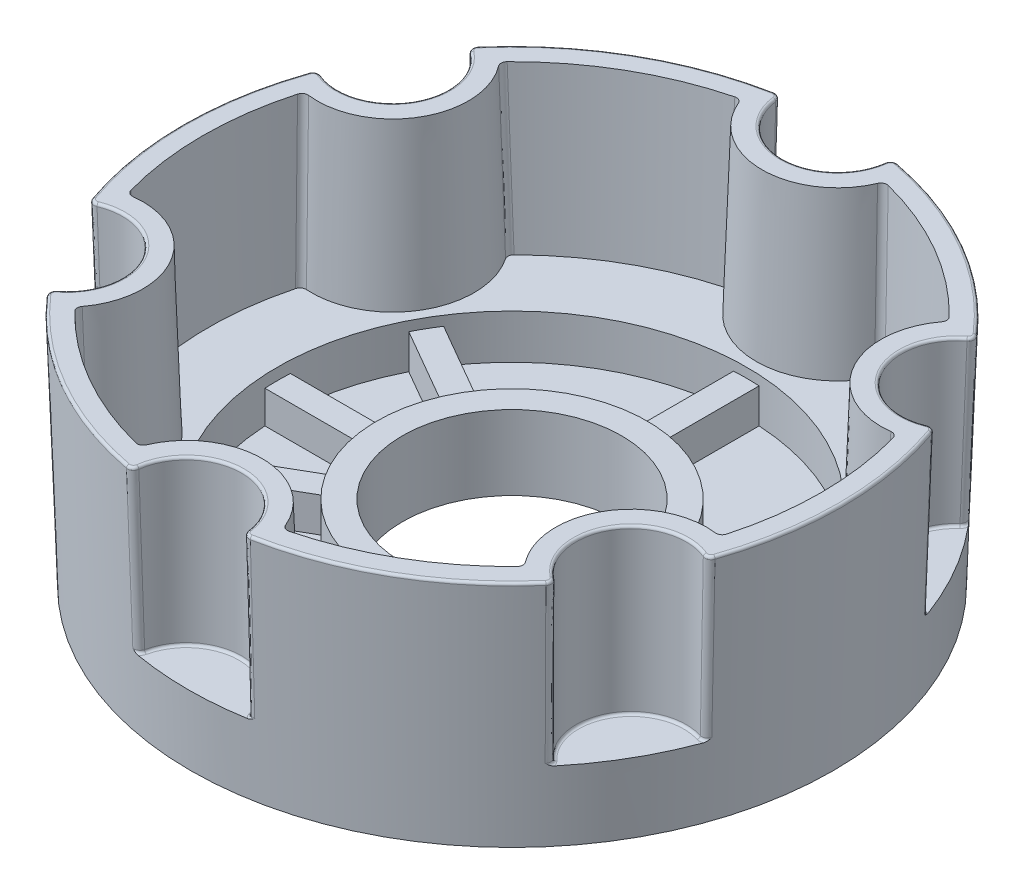
from build123d import *

# Parameters (mm, degrees)
CROQUIS1_R              = 31.5
SALIENTE_EXTRUIR1_DEPTH = 23
SALIENTE_EXTRUIR1_DRAFT = -2
CROQUIS2_R              = 5.407925635
CORTAR_EXTRUIR1_DEPTH   = 16
CROQUIS3_R              = 10.75
CORTAR_EXTRUIR2_DEPTH   = 16
CORTAR_EXTRUIR3_DEPTH   = 16
CORTAR_EXTRUIR3_DRAFT   = -2
CROQUIS6_R              = 23
CROQUIS6_R_2            = 13.25
CORTAR_EXTRUIR4_DEPTH   = 4.35
SALIENTE_EXTRUIR2_START = 3.4
SALIENTE_EXTRUIR2_DEPTH = 3.4
SALIENTE_EXTRUIR3_START = 3.2
SALIENTE_EXTRUIR3_DEPTH = 3.2
MATRIZC3_COUNT          = 4
CROQUIS10_R             = 13.25
CROQUIS10_R_2           = 10.75
SALIENTE_EXTRUIR4_DEPTH = 0.3
REDONDEO4_R             = 0.6
REDONDEO6_R             = 0.25
REDONDEO7_R             = 0.25
CROQUIS11_R             = 1
CORTAR_EXTRUIR5_DEPTH   = 1


with BuildPart() as part:
    # Croquis1 → Saliente-Extruir1 (with draft: the straight prism first)
    with BuildSketch(Plane(origin=(0, 0, 0), x_dir=(1, 0, 0), z_dir=(0, 1, 0))):
        Circle(CROQUIS1_R)
    extrude(amount=SALIENTE_EXTRUIR1_DEPTH)
    # Saliente-Extruir1: the draft: its side faces are tilted about the plane it starts from
    saliente_extruir1_sides = [part.faces().sort_by_distance(p)[0] for p in [
        (-31.5, 11.5, 0),
    ]]
    draft(saliente_extruir1_sides, Plane(origin=(0, 0, 0), x_dir=(1, 0, 0), z_dir=(0, 1, 0)), SALIENTE_EXTRUIR1_DRAFT)

    # Croquis2 → Cortar-Extruir1 (cut)
    with BuildSketch(Plane(origin=(0, 23, 0), x_dir=(1, 0, 0), z_dir=(0, 1, 0))):
        with Locations((0, 31.907925635)):
            Circle(CROQUIS2_R)
        with Locations((27.633074182, 15.953962817)):
            Circle(CROQUIS2_R)
        with Locations((27.633074182, -15.953962817)):
            Circle(CROQUIS2_R)
        with Locations((0, -31.907925635)):
            Circle(CROQUIS2_R)
        with Locations((-27.633074182, -15.953962817)):
            Circle(CROQUIS2_R)
        with Locations((-27.633074182, 15.953962817)):
            Circle(CROQUIS2_R)
    extrude(amount=-CORTAR_EXTRUIR1_DEPTH, mode=Mode.SUBTRACT)

    # Croquis3 → Cortar-Extruir2 (cut)
    with BuildSketch(Plane.XZ):
        with Locations(Location((0, 0, 0), (0, 0, 270))):
            Circle(CROQUIS3_R)
    extrude(amount=-CORTAR_EXTRUIR2_DEPTH, mode=Mode.SUBTRACT)


with BuildPart() as cortar_extruir3_tool:
    # Croquis4 → Cortar-Extruir3 (with draft: the straight prism first)
    with BuildSketch(Plane(origin=(0, 23, 0), x_dir=(1, 0, 0), z_dir=(0, 1, 0))):
        with BuildLine():
            ThreePointArc((-7, 29.483598468), (-15.151588849, 26.243321702), (-22.033545268, 20.80397706))
            ThreePointArc((-22.033545268, 20.80397706), (-21.217622393, 12.25), (-29.033545268, 8.679621407))
            ThreePointArc((-29.033545268, 8.679621407), (-30.303177698, 0), (-29.033545268, -8.679621407))
            ThreePointArc((-29.033545268, -8.679621407), (-21.217622393, -12.25), (-22.033545268, -20.80397706))
            ThreePointArc((-22.033545268, -20.80397706), (-15.151588849, -26.243321702), (-7, -29.483598468))
            ThreePointArc((-7, -29.483598468), (0, -24.5), (7, -29.483598468))
            ThreePointArc((7, -29.483598468), (15.151588849, -26.243321702), (22.033545268, -20.80397706))
            ThreePointArc((22.033545268, -20.80397706), (21.217622393, -12.25), (29.033545268, -8.679621407))
            ThreePointArc((29.033545268, -8.679621407), (30.303177698, 0), (29.033545268, 8.679621407))
            ThreePointArc((29.033545268, 8.679621407), (21.217622393, 12.25), (22.033545268, 20.80397706))
            ThreePointArc((22.033545268, 20.80397706), (15.151588849, 26.243321702), (7, 29.483598468))
            ThreePointArc((7, 29.483598468), (0, 24.5), (-7, 29.483598468))
        make_face()
    extrude(amount=-CORTAR_EXTRUIR3_DEPTH)
    # Cortar-Extruir3: the draft: its side faces are tilted about the plane it starts from
    cortar_extruir3_sides = [cortar_extruir3_tool.faces().sort_by_distance(p)[0] for p in [
        (21.217622393, 15, 12.25),
        (30.303177698, 15, 0),
        (21.217622393, 15, -12.25),
        (15.151588849, 15, -26.243321702),
        (0, 15, -24.5),
        (-15.151588849, 15, -26.243321702),
        (-21.217622393, 15, -12.25),
        (-30.303177698, 15, 0),
        (-21.217622393, 15, 12.25),
        (-15.151588849, 15, 26.243321702),
        (0, 15, 24.5),
        (15.151588849, 15, 26.243321702),
    ]]
    draft(cortar_extruir3_sides, Plane(origin=(0, 23, 0), x_dir=(1, 0, 0), z_dir=(0, 1, 0)), CORTAR_EXTRUIR3_DRAFT)


with BuildPart() as part_1:
    add(part.part)

    # Cortar-Extruir3: cut by cortar_extruir3_tool
    add(cortar_extruir3_tool.part, mode=Mode.SUBTRACT)

    # Croquis6 → Cortar-Extruir4 (cut)
    with BuildSketch(Plane(origin=(0, 7, 0), x_dir=(1, 0, 0), z_dir=(0, 1, 0))):
        with Locations(Location((0, 0, 0), (0, 0, 270))):
            Circle(CROQUIS6_R)
        with Locations(Location((0, 0, 0), (0, 0, 270))):
            Circle(CROQUIS6_R_2, mode=Mode.SUBTRACT)
    extrude(amount=-CORTAR_EXTRUIR4_DEPTH, mode=Mode.SUBTRACT)

    # Croquis8 → Saliente-Extruir2 (add)
    with BuildSketch(Plane(origin=(0, 2.65, 0), x_dir=(1, 0, 0), z_dir=(0, 1, 0)).offset(SALIENTE_EXTRUIR2_START)):
        with BuildLine():
            Line((-10.798659659, 7.677984734), (-19.264145909, 12.565535499))
            ThreePointArc((-19.264145909, 12.565535499), (-19.918584287, 11.5), (-20.514145909, 10.40047199))
            Line((-20.514145909, 10.40047199), (-12.048659659, 5.512921224))
            ThreePointArc((-12.048659659, 5.512921224), (-11.4748366, 6.625), (-10.798659659, 7.677984734))
        make_face()
        with BuildLine():
            Line((1.25, 13.190905958), (1.25, 22.966007489))
            ThreePointArc((1.25, 22.966007489), (0, 23), (-1.25, 22.966007489))
            Line((-1.25, 22.966007489), (-1.25, 13.190905958))
            ThreePointArc((-1.25, 13.190905958), (0, 13.25), (1.25, 13.190905958))
        make_face()
        with BuildLine():
            ThreePointArc((20.514145909, 10.40047199), (19.918584287, 11.5), (19.264145909, 12.565535499))
            Line((19.264145909, 12.565535499), (10.798659659, 7.677984734))
            ThreePointArc((10.798659659, 7.677984734), (11.4748366, 6.625), (12.048659659, 5.512921224))
            Line((12.048659659, 5.512921224), (20.514145909, 10.40047199))
        make_face()
        with BuildLine():
            ThreePointArc((19.264145909, -12.565535499), (19.918584287, -11.5), (20.514145909, -10.40047199))
            Line((20.514145909, -10.40047199), (12.048659659, -5.512921224))
            ThreePointArc((12.048659659, -5.512921224), (11.4748366, -6.625), (10.798659659, -7.677984734))
            Line((10.798659659, -7.677984734), (19.264145909, -12.565535499))
        make_face()
        with BuildLine():
            ThreePointArc((1.25, -13.190905958), (0, -13.25), (-1.25, -13.190905958))
            Line((-1.25, -13.190905958), (-1.25, -22.966007489))
            ThreePointArc((-1.25, -22.966007489), (0, -23), (1.25, -22.966007489))
            Line((1.25, -22.966007489), (1.25, -13.190905958))
        make_face()
        with BuildLine():
            Line((-19.264145909, -12.565535499), (-10.798659659, -7.677984734))
            ThreePointArc((-10.798659659, -7.677984734), (-11.4748366, -6.625), (-12.048659659, -5.512921224))
            Line((-12.048659659, -5.512921224), (-20.514145909, -10.40047199))
            ThreePointArc((-20.514145909, -10.40047199), (-19.918584287, -11.5), (-19.264145909, -12.565535499))
        make_face()
    extrude(amount=-SALIENTE_EXTRUIR2_DEPTH)

    # Croquis9 → Saliente-Extruir3 (add)
    with BuildSketch(Plane(origin=(0, 2.65, 0), x_dir=(1, 0, 0), z_dir=(0, 1, 0)).offset(SALIENTE_EXTRUIR3_START)):
        with BuildLine():
            ThreePointArc((13.190905958, 1.25), (13.235218244, 0.625698031), (13.25, 0))
            Line((13.25, 0), (23, 0))
            ThreePointArc((23, 0), (22.991500302, 0.625231055), (22.966007489, 1.25))
            Line((22.966007489, 1.25), (13.190905958, 1.25))
        make_face()
        with BuildLine():
            Line((23, 0), (13.25, 0))
            ThreePointArc((13.25, 0), (13.235218244, -0.625698031), (13.190905958, -1.25))
            Line((13.190905958, -1.25), (22.966007489, -1.25))
            ThreePointArc((22.966007489, -1.25), (22.991500302, -0.625231055), (23, 0))
        make_face()
    saliente_extruir3 = extrude(amount=-SALIENTE_EXTRUIR3_DEPTH)

    # MatrizC3: Saliente-Extruir3 ×4 about axis
    matrizc3_axis = Axis((0, 16, 0), (0, -1, 0))
    for i in range(1, MATRIZC3_COUNT):
        add(saliente_extruir3.rotate(matrizc3_axis, i * 360 / MATRIZC3_COUNT))

    # Croquis10 → Saliente-Extruir4 (add)
    with BuildSketch(Plane(origin=(0, 7, 0), x_dir=(1, 0, 0), z_dir=(0, 1, 0))):
        with Locations(Location((0, 0, 0), (0, 0, 270))):
            Circle(CROQUIS10_R)
        with Locations(Location((0, 0, 0), (0, 0, 90))):
            Circle(CROQUIS10_R_2, mode=Mode.SUBTRACT)
    extrude(amount=SALIENTE_EXTRUIR4_DEPTH)

    # Redondeo4
    redondeo4_edges = [part_1.edges().sort_by_distance(p)[0] for p in [
        (-5.397088961, 15.000026797, -31.565740865),
        (5.397088961, 15.000026797, -31.565740865),
        (-30.035277959, 15.000026797, -11.108854286),
        (-24.638188999, 15.000026797, -20.456886578),
        (-24.638188998, 15.000026797, 20.456886579),
        (-30.035277959, 15.000026797, 11.108854287),
        (5.397088963, 15.000026797, 31.565740865),
        (-5.397088961, 15.000026797, 31.565740865),
        (30.03527796, 15.000026797, 11.108854285),
        (24.638188998, 15.000026797, 20.456886579),
        (24.638188998, 15.000026797, -20.45688658),
        (30.035277959, 15.000026797, -11.108854286),
        (-21.659184539, 15.000091201, -20.792045976),
        (-7.176847742, 15.000091201, -29.153427024),
        (7.176847742, 15.000091201, -29.153427024),
        (21.659184539, 15.000091201, -20.792045976),
        (28.836032282, 15.000091201, -8.361381048),
        (28.836032282, 15.000091201, 8.361381048),
        (21.659184539, 15.000091201, 20.792045976),
        (7.176847742, 15.000091201, 29.153427024),
        (-7.176847742, 15.000091201, 29.153427024),
        (-21.659184539, 15.000091201, 20.792045976),
        (-28.836032282, 15.000091201, 8.361381048),
        (-28.836032282, 15.000091201, -8.361381048),
    ]]
    fillet(redondeo4_edges, radius=REDONDEO4_R)

    # Redondeo6
    redondeo6_edges = [part_1.edges().sort_by_distance(p)[0] for p in [
        (-5.606476776, 23, -31.624073424),
        (0, 23, -26.5),
        (5.606476778, 23, -31.624073424),
        (16.151588851, 23, -27.975372509),
        (24.584012568, 23, -20.667388026),
        (22.9496732, 23, -13.25),
        (30.190489346, 23, -10.956685396),
        (31.852344098, 23, -5.378054007),
        (30.190489345, 23, 10.956685398),
        (22.9496732, 23, 13.25),
        (24.584012568, 23, 20.667388028),
        (16.151588848, 23, 27.975372511),
        (5.606476776, 23, 31.624073424),
        (0, 23, 26.5),
        (-5.606476778, 23, 31.624073424),
        (-16.151588851, 23, 27.975372509),
        (-24.584012568, 23, 20.667388026),
        (-22.9496732, 23, 13.25),
        (-30.190489346, 23, 10.956685396),
        (-32.303177698, 23, -2e-09),
        (-30.190489345, 23, -10.956685398),
        (-22.9496732, 23, -13.25),
        (-24.584012568, 23, -20.667388028),
        (-16.151588848, 23, -27.975372511),
    ]]
    fillet(redondeo6_edges, radius=REDONDEO6_R)

    # Redondeo7
    redondeo7_edges = [part_1.edges().sort_by_distance(p)[0] for p in [
        (5.532246703, 7, 31.089704263),
        (-5.532246702, 7, 31.089704263),
        (-24.158350336, 7, 20.335918316),
        (-29.690597039, 7, 10.753785947),
        (-29.690597039, 7, -10.753785946),
        (-24.158350336, 7, -20.335918315),
        (-5.532246703, 7, -31.089704263),
        (5.532246702, 7, -31.089704263),
        (24.158350336, 7, -20.335918316),
        (29.690597039, 7, -10.753785947),
        (29.690597039, 7, 10.753785946),
        (24.158350336, 7, 20.335918315),
        (0, 7, 26.5),
        (-22.9496732, 7, 13.25),
        (-22.9496732, 7, -13.25),
        (0, 7, -26.5),
        (22.9496732, 7, -13.25),
        (22.9496732, 7, 13.25),
    ]]
    fillet(redondeo7_edges, radius=REDONDEO7_R)

    # Croquis11 → Cortar-Extruir5 (cut)
    with BuildSketch(Plane(origin=(0, 7, 0), x_dir=(1, 0, 0), z_dir=(0, 1, 0))):
        with Locations((23.8125, 0)):
            Circle(CROQUIS11_R)
    extrude(amount=-CORTAR_EXTRUIR5_DEPTH, mode=Mode.SUBTRACT)


solid = part_1.part
